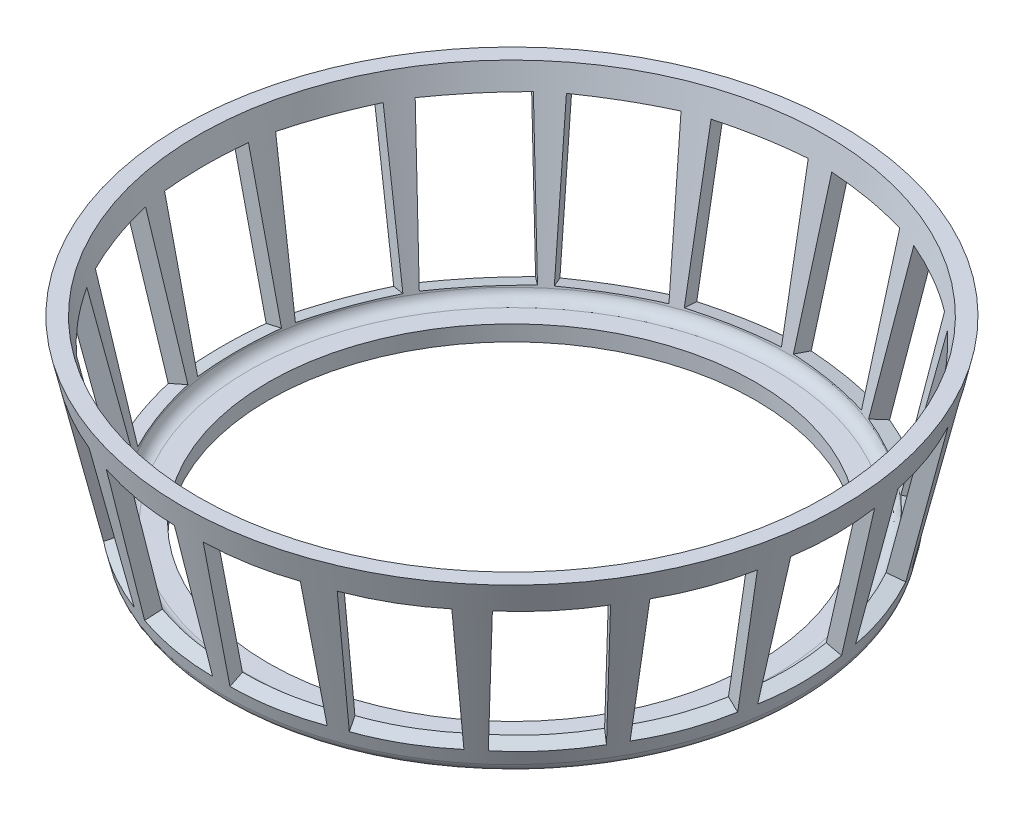
from build123d import *

# Parameters (mm, degrees)
SKETCH3_W          = 12.35
SKETCH3_H          = 7
CUT_EXTRUDE1_DEPTH = 10
CIRPATTERN1_COUNT  = 18


with BuildPart() as part:
    # Sketch1 → Revolve1 (revolve)
    with BuildSketch(Plane.XY, mode=Mode.PRIVATE) as revolve1_sk:
        with BuildLine():
            Line((-27.5, 16.23), (-23.995243086, 0.778791907))
            ThreePointArc((-23.995243086, 0.778791907), (-23.644032445, 0.218588427), (-23.020016456, 0))
            Line((-23.020016456, 0), (-20.318591765, 0))
            Line((-20.318591765, 0), (-20.318591765, 1.3))
            Line((-20.318591765, 1.3), (-21.981868555, 1.3))
            ThreePointArc((-21.981868555, 1.3), (-22.605884543, 1.518588427), (-22.957095185, 2.078791907))
            Line((-22.957095185, 2.078791907), (-26.166976516, 16.23))
            Line((-26.166976516, 16.23), (-27.5, 16.23))
        make_face()
    revolve(revolve1_sk.sketch.rotate(Axis((0, 12.177236693, 0), (0, -1, 0)), 270), axis=Axis((0, 12.177236693, 0), (0, -1, 0)))

    # Sketch3 → Cut-Extrude1 (cut)
    with BuildSketch(Plane(origin=(22.653076131, -5.138337708, 0), x_dir=(0.22120809279024437, 0.9752266299092242, 0), z_dir=(0.975226629909224, -0.22120809279024434, 0))):
        with Locations((13.386150755, 0)):
            Rectangle(SKETCH3_W, SKETCH3_H)
    cut_extrude1 = extrude(amount=-CUT_EXTRUDE1_DEPTH, mode=Mode.SUBTRACT)

    # CirPattern1: Cut-Extrude1 ×18 about axis
    cirpattern1_axis = Axis((0, 0, 0), (0, 1, 0))
    for i in range(1, CIRPATTERN1_COUNT):
        add(cut_extrude1.rotate(cirpattern1_axis, i * 360 / CIRPATTERN1_COUNT), mode=Mode.SUBTRACT)


solid = part.part
